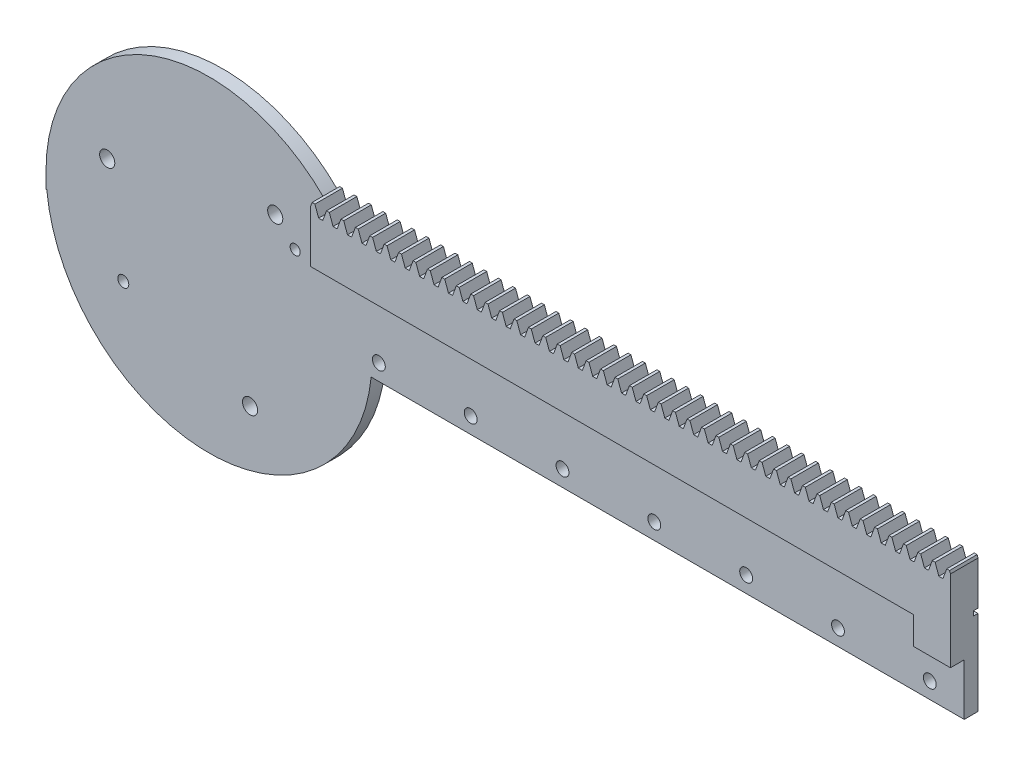
from build123d import *

# Parameters (mm, degrees)
BLANKSKE_W          = 200
BLANKSKE_H          = 11
BLANK_DEPTH         = 3
TOOTHCUTSIM_DEPTH   = 201.324736366
TEETHCUTS_COUNT     = 65
TEETHCUTS_PITCH     = 3.14159265
SKETCH_5_W          = 200
SKETCH_5_H          = 3
EXTRUDE_3_DEPTH     = 18.5
SKETCH_6_R          = 35.5
EXTRUDE_4_DEPTH     = 3
EXTRUDE_6_DEPTH     = 3
CUT_EXTRUDE_START   = -3
CUT_EXTRUDE_1_DEPTH = 3
SKETCH_9_R          = 1.4
CUT_EXTRUDE_2_DEPTH = 10
SKETCH_11_W         = 8
SKETCH_11_H         = 6
EXTRUDE_7_DEPTH     = 3
SKETCH_12_W         = 129.164252447
SKETCH_12_H         = 1
CUT_EXTRUDE_3_DEPTH = 1
SKETCH_13_R         = 1.65
SKETCH_13_R_2       = 1.1
SKETCH_13_R_3       = 1.2
CUT_EXTRUDE_4_DEPTH = 207.364362233


with BuildPart() as part:
    # BlankSke → Blank (new body)
    with BuildSketch(Plane.XY):
        with Locations((100, 5.5)):
            Rectangle(BLANKSKE_W, BLANKSKE_H)
    extrude(amount=-BLANK_DEPTH)

    # TooCutSkeSim → ToothCutSim (cut, through all)
    with BuildSketch(Plane.XY):
        Polygon((0.44443537, 8.75), (-0.44443537, 8.75), (-1.272613241, 11.0254), (1.272613241, 11.0254), align=None)
    toothcutsim = extrude(amount=-TOOTHCUTSIM_DEPTH, mode=Mode.SUBTRACT)

    # TeethCuts: ToothCutSim ×65
    with Locations(*[(i * TEETHCUTS_PITCH, 0, 0) for i in range(1, TEETHCUTS_COUNT)]):
        add(toothcutsim, mode=Mode.SUBTRACT)

    # 草图5 → 凸台-拉伸3 (add)
    with BuildSketch(Plane.XZ):
        with Locations((100, -1.5)):
            Rectangle(SKETCH_5_W, SKETCH_5_H)
    extrude(amount=EXTRUDE_3_DEPTH)

    # 草图6 → 凸台-拉伸4 (add)
    with BuildSketch(Plane(origin=(0, 0, -3), x_dir=(-1, 0, 0), z_dir=(0, 0, -1))):
        with Locations((-35.5, -15)):
            Circle(SKETCH_6_R)
    extrude(amount=-EXTRUDE_4_DEPTH)

    # 草图7 → 凸台-拉伸6 (add)
    with BuildSketch(Plane.XY):
        Polygon((200, 10.446551454), (200, -1.25), (60.620321804, -1.25), (60.620321804, 10.0842467), (60.953628747, 11), (61.568484603, 11), (62.38741763, 8.75), (63.27628837, 8.75), (64.095221397, 11), (64.710077253, 11), (65.52901028, 8.75), (66.41788102, 8.75), (67.236814047, 11), (67.851669903, 11), (68.67060293, 8.75), (69.55947367, 8.75), (70.378406697, 11), (70.993262553, 11), (71.81219558, 8.75), (72.70106632, 8.75), (73.519999347, 11), (74.134855203, 11), (74.95378823, 8.75), (75.84265897, 8.75), (76.661591997, 11), (77.276447853, 11), (78.09538088, 8.75), (78.98425162, 8.75), (79.803184647, 11), (80.418040503, 11), (81.23697353, 8.75), (82.12584427, 8.75), (82.944777297, 11), (83.559633153, 11), (84.37856618, 8.75), (85.26743692, 8.75), (86.086369947, 11), (86.701225803, 11), (87.52015883, 8.75), (88.40902957, 8.75), (89.227962597, 11), (89.842818453, 11), (90.66175148, 8.75), (91.55062222, 8.75), (92.369555247, 11), (92.984411103, 11), (93.80334413, 8.75), (94.69221487, 8.75), (95.511147897, 11), (96.126003753, 11), (96.94493678, 8.75), (97.83380752, 8.75), (98.652740547, 11), (99.267596403, 11), (100.08652943, 8.75), (100.97540017, 8.75), (101.794333197, 11), (102.409189053, 11), (103.22812208, 8.75), (104.11699282, 8.75), (104.935925847, 11), (105.550781703, 11), (106.36971473, 8.75), (107.25858547, 8.75), (108.077518497, 11), (108.692374353, 11), (109.51130738, 8.75), (110.40017812, 8.75), (111.219111147, 11), (111.833967003, 11), (112.65290003, 8.75), (113.54177077, 8.75), (114.360703797, 11), (114.975559653, 11), (115.79449268, 8.75), (116.68336342, 8.75), (117.502296447, 11), (118.117152303, 11), (118.93608533, 8.75), (119.82495607, 8.75), (120.643889097, 11), (121.258744953, 11), (122.07767798, 8.75), (122.96654872, 8.75), (123.785481747, 11), (124.400337603, 11), (125.21927063, 8.75), (126.10814137, 8.75), (126.927074397, 11), (127.541930253, 11), (128.36086328, 8.75), (129.24973402, 8.75), (130.068667047, 11), (130.683522903, 11), (131.50245593, 8.75), (132.39132667, 8.75), (133.210259697, 11), (133.825115553, 11), (134.64404858, 8.75), (135.53291932, 8.75), (136.351852347, 11), (136.966708203, 11), (137.78564123, 8.75), (138.67451197, 8.75), (139.493444997, 11), (140.108300853, 11), (140.92723388, 8.75), (141.81610462, 8.75), (142.635037647, 11), (143.249893503, 11), (144.06882653, 8.75), (144.95769727, 8.75), (145.776630297, 11), (146.391486153, 11), (147.21041918, 8.75), (148.09928992, 8.75), (148.918222947, 11), (149.533078803, 11), (150.35201183, 8.75), (151.24088257, 8.75), (152.059815597, 11), (152.674671453, 11), (153.49360448, 8.75), (154.38247522, 8.75), (155.201408247, 11), (155.816264103, 11), (156.63519713, 8.75), (157.52406787, 8.75), (158.343000897, 11), (158.957856753, 11), (159.77678978, 8.75), (160.66566052, 8.75), (161.484593547, 11), (162.099449403, 11), (162.91838243, 8.75), (163.80725317, 8.75), (164.626186197, 11), (165.241042053, 11), (166.05997508, 8.75), (166.94884582, 8.75), (167.767778847, 11), (168.382634703, 11), (169.20156773, 8.75), (170.09043847, 8.75), (170.909371497, 11), (171.524227353, 11), (172.34316038, 8.75), (173.23203112, 8.75), (174.050964147, 11), (174.665820003, 11), (175.48475303, 8.75), (176.37362377, 8.75), (177.192556797, 11), (177.807412653, 11), (178.62634568, 8.75), (179.51521642, 8.75), (180.334149447, 11), (180.949005303, 11), (181.76793833, 8.75), (182.65680907, 8.75), (183.475742097, 11), (184.090597953, 11), (184.90953098, 8.75), (185.79840172, 8.75), (186.617334747, 11), (187.232190603, 11), (188.05112363, 8.75), (188.93999437, 8.75), (189.758927397, 11), (190.373783253, 11), (191.19271628, 8.75), (192.08158702, 8.75), (192.900520047, 11), (193.515375903, 11), (194.33430893, 8.75), (195.22317967, 8.75), (196.042112697, 11), (196.656968553, 11), (197.47590158, 8.75), (198.36477232, 8.75), (199.183705347, 11), (199.798561203, 11), align=None)
    extrude(amount=EXTRUDE_6_DEPTH)

    # 草图8 → 切除-拉伸1 (cut)
    with BuildSketch(Plane.XY.offset(CUT_EXTRUDE_START)):
        with BuildLine():
            Line((35.5, 20.5), (0, 20.5))
            Line((0, 20.5), (0, -15))
            ThreePointArc((0, -15), (10.397709268, 10.102290732), (35.5, 20.5))
        make_face()
    extrude(amount=CUT_EXTRUDE_1_DEPTH, mode=Mode.SUBTRACT)

    # 草图9 → 切除-拉伸2 (cut)
    with BuildSketch(Plane.XY):
        with Locations((72.5, -15)):
            Circle(SKETCH_9_R)
        with Locations((92.5, -15)):
            Circle(SKETCH_9_R)
        with Locations((112.5, -15)):
            Circle(SKETCH_9_R)
        with Locations((132.5, -15)):
            Circle(SKETCH_9_R)
        with Locations((152.5, -15)):
            Circle(SKETCH_9_R)
        with Locations((172.5, -15)):
            Circle(SKETCH_9_R)
        with Locations((192.5, -15)):
            Circle(SKETCH_9_R)
    extrude(amount=-CUT_EXTRUDE_2_DEPTH, mode=Mode.SUBTRACT)

    # 草图11 → 凸台-拉伸7 (add)
    with BuildSketch(Plane.XY):
        with Locations((196, -4.25)):
            Rectangle(SKETCH_11_W, SKETCH_11_H)
    extrude(amount=EXTRUDE_7_DEPTH)

    # 草图12 → 切除-拉伸3 (cut)
    with BuildSketch(Plane(origin=(0, 0, -3), x_dir=(-1, 0, 0), z_dir=(0, 0, -1))):
        with Locations((-135.417873777, 0.5)):
            Rectangle(SKETCH_12_W, SKETCH_12_H)
    extrude(amount=-CUT_EXTRUDE_3_DEPTH, mode=Mode.SUBTRACT)

    # 草图13 → 切除-拉伸4 (cut, through all)
    with BuildSketch(Plane(origin=(0, 0, -3), x_dir=(-1, 0, 0), z_dir=(0, 0, -1))):
        with Locations((-13.33220241, -6.055099218)):
            Circle(SKETCH_13_R)
        with Locations((-49.924978336, 1.687720036)):
            Circle(SKETCH_13_R)
        with Locations((-44.444900782, -37.16779759)):
            Circle(SKETCH_13_R)
        with Locations((-54.280086339, -2.725296048)):
            Circle(SKETCH_13_R_2)
        with Locations((-16.832380977, -27.445079349)):
            Circle(SKETCH_13_R_3)
    extrude(amount=-CUT_EXTRUDE_4_DEPTH, mode=Mode.SUBTRACT)


solid = part.part
